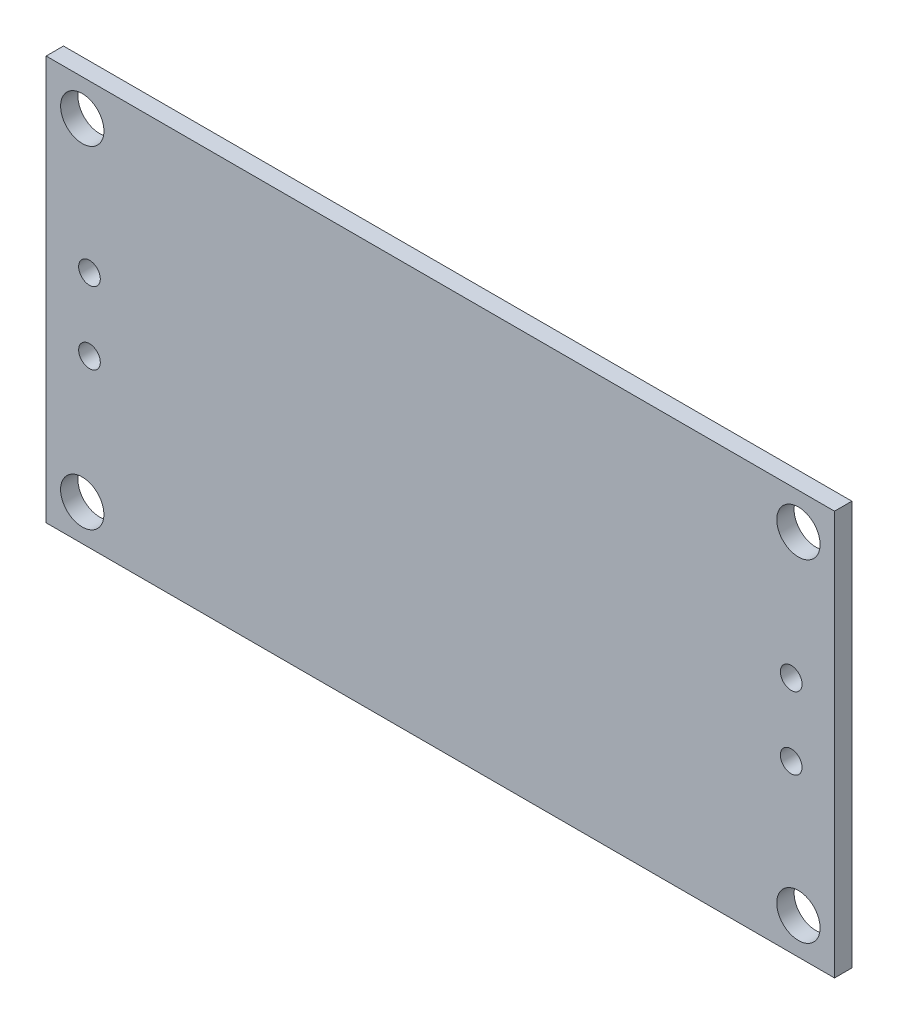
from build123d import *

# Parameters (mm, degrees)
ESBO_O1_W                = 54.6
ESBO_O1_H                = 28
RESSALTO_EXTRUS_O1_DEPTH = 1.2
ESBO_O2_R                = 1.5
CORTE_EXTRUS_O1_DEPTH    = 31.703908546
ESBO_O3_R                = 0.75
CORTE_EXTRUS_O2_DEPTH    = 31.703908546


with BuildPart() as part:
    # Esboço1 → Ressalto-extrusão1 (new body)
    with BuildSketch(Plane.XY):
        Rectangle(ESBO_O1_W, ESBO_O1_H)
    extrude(amount=RESSALTO_EXTRUS_O1_DEPTH)

    # Esboço2 → Corte-extrusão1 (cut, through all)
    with BuildSketch(Plane.XY.offset(1.2)):
        with Locations((-24.8, 11.5)):
            Circle(ESBO_O2_R)
        with Locations(Location((24.8, 11.5, 0), (0, 0, 180))):
            Circle(ESBO_O2_R)
        with Locations(Location((-24.8, -11.5, 0), (0, 0, 180))):
            Circle(ESBO_O2_R)
        with Locations((24.8, -11.5)):
            Circle(ESBO_O2_R)
    extrude(amount=-CORTE_EXTRUS_O1_DEPTH, mode=Mode.SUBTRACT)

    # Esboço3 → Corte-extrusão2 (cut, through all)
    with BuildSketch(Plane.XY.offset(1.2)):
        with Locations((24.3, 2.5)):
            Circle(ESBO_O3_R)
        with Locations(Location((24.3, -2.5, 0), (0, 0, 180))):
            Circle(ESBO_O3_R)
        with Locations((-24.3, -2.5)):
            Circle(ESBO_O3_R)
        with Locations(Location((-24.3, 2.5, 0), (0, 0, 180))):
            Circle(ESBO_O3_R)
    extrude(amount=-CORTE_EXTRUS_O2_DEPTH, mode=Mode.SUBTRACT)


solid = part.part
